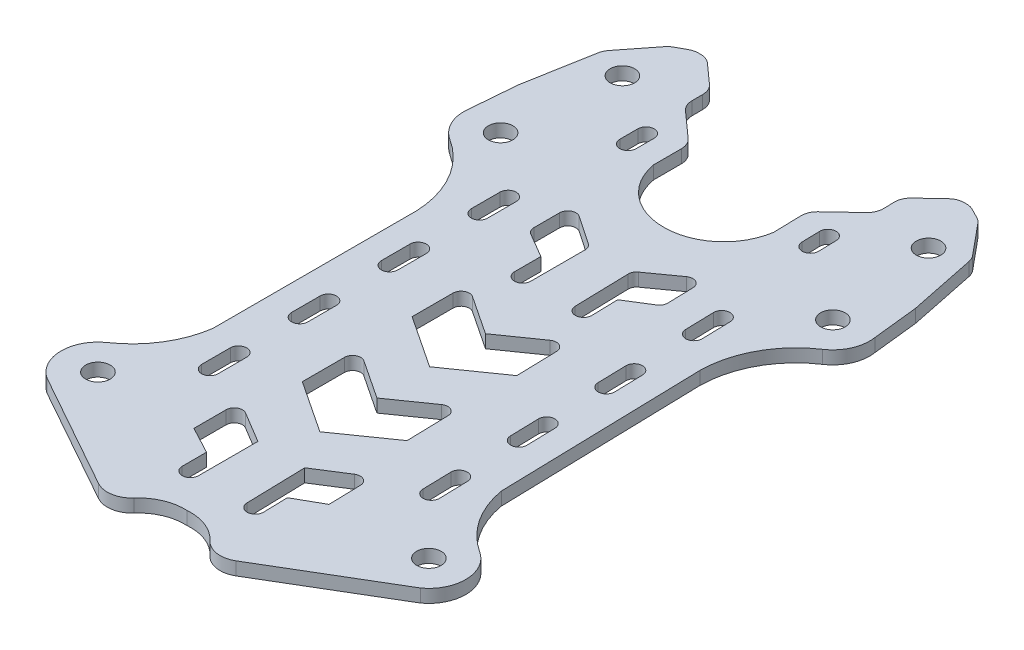
from build123d import *

# Parameters (mm, degrees)
SKETCH1_R           = 1.5
BOSS_EXTRUDE2_DEPTH = 1.6


with BuildPart() as part:
    # Sketch1 → Boss-Extrude2 (new body)
    with BuildSketch(Plane(origin=(0, 0, 0), x_dir=(1, 0, 0), z_dir=(0, 1, 0))):
        with BuildLine():
            Line((453.589712256, 423.881802968), (467.945856876, 415.84408128))
            ThreePointArc((467.945856876, 415.84408128), (469.915446977, 415.504375154), (471.661326417, 416.477303928))
            ThreePointArc((471.661326417, 416.477303928), (473.724813191, 417.95928402), (476.227640643, 418.395285632))
            ThreePointArc((476.227640643, 418.395285632), (478.740771184, 418.023240551), (480.841373273, 416.594355138))
            ThreePointArc((480.841373273, 416.594355138), (482.611491962, 415.666257489), (484.571780229, 416.056071966))
            Line((484.571780229, 416.056071966), (498.718319207, 424.457220296))
            ThreePointArc((498.718319207, 424.457220296), (500.60414794, 428.220847289), (498.55289687, 431.896933143))
            ThreePointArc((498.55289687, 431.896933143), (495.165676859, 435.255036212), (493.406451682, 439.68845954))
            Line((493.406451682, 439.68845954), (492.770294469, 464.630549387))
            ThreePointArc((492.770294469, 464.630549387), (494.201033295, 470.159578476), (498.048211328, 474.380525932))
            ThreePointArc((498.048211328, 474.380525932), (499.674169908, 476.324215001), (499.992044343, 478.838300192))
            Line((499.992044343, 478.838300192), (499.38363983, 484.405897714))
            Line((499.38363983, 484.405897714), (497.693878983, 492.626839073))
            ThreePointArc((497.693878983, 492.626839073), (497.538189212, 493.088987767), (497.275280625, 493.499718573))
            Line((497.275280625, 493.499718573), (494.171978496, 497.247496024))
            ThreePointArc((494.171978496, 497.247496024), (493.886616044, 497.52911277), (493.550818117, 497.748154942))
            Line((493.550818117, 497.748154942), (492.36034492, 498.364291217))
            ThreePointArc((492.36034492, 498.364291217), (491.889311804, 498.537203924), (491.390064396, 498.587433654))
            Line((491.390064396, 498.587433654), (491.099023272, 498.580010543))
            ThreePointArc((491.099023272, 498.580010543), (490.388435585, 498.429983084), (489.77827067, 498.036102551))
            Line((489.77827067, 498.036102551), (487.452310196, 495.843896216))
            ThreePointArc((487.452310196, 495.843896216), (486.977868904, 495.157603094), (486.824707159, 494.33746026))
            Line((486.824707159, 494.33746026), (486.857438427, 493.054151331))
            ThreePointArc((486.857438427, 493.054151331), (486.704276682, 492.234008496), (486.22983539, 491.547715375))
            Line((486.22983539, 491.547715375), (483.18736048, 488.680197699))
            ThreePointArc((483.18736048, 488.680197699), (482.712919188, 487.993904577), (482.559757443, 487.173761743))
            Line((482.559757443, 487.173761743), (482.646361727, 483.778230276))
            ThreePointArc((482.646361727, 483.778230276), (480.207052977, 479.354277202), (475.472858534, 477.591044107))
            ThreePointArc((475.472858534, 477.591044107), (470.695245902, 479.232995847), (468.143932306, 483.593315435))
            Line((468.143932306, 483.593315435), (468.143932306, 486.98995116))
            ThreePointArc((468.143932306, 486.98995116), (467.969909108, 487.805922186), (467.47812359, 488.479895325))
            Line((467.47812359, 488.479895325), (464.363524478, 491.268906543))
            ThreePointArc((464.363524478, 491.268906543), (463.87173896, 491.942879682), (463.697715763, 492.758850708))
            Line((463.697715763, 492.758850708), (463.697715763, 494.042576981))
            ThreePointArc((463.697715763, 494.042576981), (463.523692566, 494.858548007), (463.031907047, 495.532521147))
            Line((463.031907047, 495.532521147), (460.650807896, 497.664709593))
            ThreePointArc((460.650807896, 497.664709593), (460.030798545, 498.042904653), (459.316616611, 498.174765428))
            Line((459.316616611, 498.174765428), (459.025480838, 498.174765428))
            ThreePointArc((459.025480838, 498.174765428), (458.527676448, 498.111822678), (458.061205236, 497.926956217))
            Line((458.061205236, 497.926956217), (456.886828739, 497.280666663))
            ThreePointArc((456.886828739, 497.280666663), (456.556724917, 497.053133837), (456.278635641, 496.764332737))
            Line((456.278635641, 496.764332737), (453.271899778, 492.938648567))
            ThreePointArc((453.271899778, 492.938648567), (453.019549098, 492.52134789), (452.875693384, 492.055379807))
            Line((452.875693384, 492.055379807), (451.396091861, 483.794027141))
            Line((451.396091861, 483.794027141), (450.929842608, 478.212727126))
            ThreePointArc((450.929842608, 478.212727126), (451.311715525, 475.707564142), (452.986703892, 473.805964165))
            ThreePointArc((452.986703892, 473.805964165), (456.940253019, 469.684480748), (458.511500789, 464.193728824))
            Line((458.511500789, 464.193728824), (458.511500789, 439.243527583))
            ThreePointArc((458.511500789, 439.243527583), (456.86588688, 434.766690476), (453.565389879, 431.323314926))
            ThreePointArc((453.565389879, 431.323314926), (451.608535123, 427.596123273), (453.589712256, 423.881802968))
        make_face()
        with Locations(Location((456.108511087, 427.61083132, 0), (0, 0, 270))):
            Circle(SKETCH1_R, mode=Mode.SUBTRACT)
        with BuildLine():
            Line((469.460195139, 432.320358064), (473.246975462, 430.049235602))
            Line((473.246975462, 430.049235602), (473.246975462, 422.799270755))
            Line((473.246975462, 422.799270755), (473.246975462, 422.774922206))
            ThreePointArc((473.246975462, 422.774922206), (472.240962321, 421.787115008), (471.247049571, 422.78709648))
            Line((471.247049571, 422.78709648), (471.247049571, 425.761347508))
            Line((471.247049571, 425.761347508), (467.945856876, 427.521589717))
            Line((467.945856876, 427.521589717), (467.945856876, 431.462770662))
            ThreePointArc((467.945856876, 431.462770662), (468.453078154, 432.332925321), (469.460195139, 432.320358064))
        make_face(mode=Mode.SUBTRACT)
        with BuildLine():
            ThreePointArc((461.635951748, 438.279668788), (462.635951748, 439.279668788), (463.635951748, 438.279668788))
            Line((463.635951748, 438.279668788), (463.635951748, 434.779668788))
            ThreePointArc((463.635951748, 434.779668788), (462.635951748, 433.779668788), (461.635951748, 434.779668788))
            Line((461.635951748, 434.779668788), (461.635951748, 438.279668788))
        make_face(mode=Mode.SUBTRACT)
        with BuildLine():
            ThreePointArc((461.635951748, 449.279668788), (462.635951748, 450.279668788), (463.635951748, 449.279668788))
            Line((463.635951748, 449.279668788), (463.635951748, 445.779668788))
            ThreePointArc((463.635951748, 445.779668788), (462.635951748, 444.779668788), (461.635951748, 445.779668788))
            Line((461.635951748, 445.779668788), (461.635951748, 449.279668788))
        make_face(mode=Mode.SUBTRACT)
        with BuildLine():
            Line((479.09504805, 422.873837256), (478.910195135, 430.121445115))
            Line((478.910195135, 430.121445115), (482.637837379, 432.488381058))
            ThreePointArc((482.637837379, 432.488381058), (483.644306517, 432.52662277), (484.173549297, 431.669683661))
            Line((484.173549297, 431.669683661), (484.274037893, 427.729784007))
            Line((484.274037893, 427.729784007), (481.018799458, 425.885943293))
            Line((481.018799458, 425.885943293), (481.094634167, 422.912659204))
            ThreePointArc((481.094634167, 422.912659204), (480.126541147, 421.887660959), (479.095668867, 422.849496622))
            Line((479.095668867, 422.849496622), (479.09504805, 422.873837256))
        make_face(mode=Mode.SUBTRACT)
        with Locations(Location((496.105259921, 428.120814319, 0), (0, 0, 270))):
            Circle(SKETCH1_R, mode=Mode.SUBTRACT)
        with BuildLine():
            Line((471.187972381, 445.082310129), (475.927466202, 441.937250248))
            Line((475.927466202, 441.937250248), (480.585229362, 445.202130901))
            ThreePointArc((480.585229362, 445.202130901), (481.609394575, 445.276205059), (482.158891125, 444.408763473))
            Line((482.158891125, 444.408763473), (482.290119782, 439.26362501))
            Line((482.290119782, 439.26362501), (476.017617673, 434.866885615))
            Line((476.017617673, 434.866885615), (469.635050772, 439.102265143))
            Line((469.635050772, 439.102265143), (469.635050772, 444.249076852))
            ThreePointArc((469.635050772, 444.249076852), (470.162251454, 445.130246986), (471.187972381, 445.082310129))
        make_face(mode=Mode.SUBTRACT)
        with BuildLine():
            Line((471.015671468, 458.540811838), (475.755868023, 455.395285632))
            Line((475.755868023, 455.395285632), (480.4143218, 458.660650375))
            ThreePointArc((480.4143218, 458.660650375), (481.438487013, 458.734724533), (481.987983563, 457.867282948))
            Line((481.987983563, 457.867282948), (482.115510052, 452.867296983))
            Line((482.115510052, 452.867296983), (475.844152311, 448.471359738))
            Line((475.844152311, 448.471359738), (469.462749858, 452.705966555))
            Line((469.462749858, 452.705966555), (469.462749858, 457.707578561))
            ThreePointArc((469.462749858, 457.707578561), (469.98995054, 458.588748694), (471.015671468, 458.540811838))
        make_face(mode=Mode.SUBTRACT)
        with BuildLine():
            Line((488.397482052, 435.095393437), (488.308242281, 438.594255575))
            ThreePointArc((488.308242281, 438.594255575), (489.282420101, 439.619427549), (490.307592075, 438.64524973))
            Line((490.307592075, 438.64524973), (490.396831846, 435.146387592))
            ThreePointArc((490.396831846, 435.146387592), (489.422654027, 434.121215618), (488.397482052, 435.095393437))
        make_face(mode=Mode.SUBTRACT)
        with BuildLine():
            Line((488.117014201, 446.0918173), (488.02777443, 449.590679439))
            ThreePointArc((488.02777443, 449.590679439), (489.001952249, 450.615851413), (490.027124223, 449.641673593))
            Line((490.027124223, 449.641673593), (490.116363994, 446.142811455))
            ThreePointArc((490.116363994, 446.142811455), (489.142186175, 445.117639481), (488.117014201, 446.0918173))
        make_face(mode=Mode.SUBTRACT)
        with BuildLine():
            ThreePointArc((461.635951748, 460.279668788), (462.635951748, 461.279668788), (463.635951748, 460.279668788))
            Line((463.635951748, 460.279668788), (463.635951748, 456.779668788))
            ThreePointArc((463.635951748, 456.779668788), (462.635951748, 455.779668788), (461.635951748, 456.779668788))
            Line((461.635951748, 456.779668788), (461.635951748, 460.279668788))
        make_face(mode=Mode.SUBTRACT)
        with Locations(Location((455.389407771, 477.61083132, 0), (0, 0, 270))):
            Circle(SKETCH1_R, mode=Mode.SUBTRACT)
        with BuildLine():
            ThreePointArc((461.635951748, 471.279668788), (462.635951748, 472.279668788), (463.635951748, 471.279668788))
            Line((463.635951748, 471.279668788), (463.635951748, 467.779668788))
            ThreePointArc((463.635951748, 467.779668788), (462.635951748, 466.779668788), (461.635951748, 467.779668788))
            Line((461.635951748, 467.779668788), (461.635951748, 471.279668788))
        make_face(mode=Mode.SUBTRACT)
        with BuildLine():
            Line((472.965894623, 470.380866665), (472.965894623, 463.732394135))
            ThreePointArc((472.965894623, 463.732394135), (471.965894623, 462.732394135), (470.965894623, 463.732394135))
            Line((470.965894623, 463.732394135), (470.965894623, 466.963746591))
            Line((470.965894623, 466.963746591), (467.970293389, 468.729657655))
            ThreePointArc((467.970293389, 468.729657655), (467.609840744, 469.095045392), (467.47812359, 469.591114842))
            Line((467.47812359, 469.591114842), (467.47812359, 472.748724337))
            ThreePointArc((467.47812359, 472.748724337), (468.0099832, 473.63237844), (469.03981274, 473.576072691))
            Line((469.03981274, 473.576072691), (472.527583773, 471.208215019))
            ThreePointArc((472.527583773, 471.208215019), (472.849548727, 470.849007055), (472.965894623, 470.380866665))
        make_face(mode=Mode.SUBTRACT)
        with Locations(Location((456.798969195, 491.11083132, 0), (0, 0, 270))):
            Circle(SKETCH1_R, mode=Mode.SUBTRACT)
        with BuildLine():
            ThreePointArc((463.363524478, 486.431340003), (464.363524478, 487.431340003), (465.363524478, 486.431340003))
            Line((465.363524478, 486.431340003), (465.363524478, 484.231340003))
            ThreePointArc((465.363524478, 484.231340003), (464.363524478, 483.231340003), (463.363524478, 484.231340003))
            Line((463.363524478, 484.231340003), (463.363524478, 486.431340003))
        make_face(mode=Mode.SUBTRACT)
        with BuildLine():
            Line((483.198924026, 468.923832005), (480.249322243, 467.082115968))
            Line((480.249322243, 467.082115968), (480.331712286, 463.851814036))
            ThreePointArc((480.331712286, 463.851814036), (479.357534467, 462.826642062), (478.332362493, 463.800819881))
            Line((478.332362493, 463.800819881), (478.162845874, 470.447130971))
            ThreePointArc((478.162845874, 470.447130971), (478.267217734, 470.918085647), (478.579919263, 471.285385996))
            Line((478.579919263, 471.285385996), (482.006182959, 473.741401838))
            ThreePointArc((482.006182959, 473.741401838), (483.034242067, 473.823946926), (483.588459364, 472.954140967))
            Line((483.588459364, 472.954140967), (483.668969178, 469.797558022))
            ThreePointArc((483.668969178, 469.797558022), (483.549943167, 469.298291443), (483.198924026, 468.923832005))
        make_face(mode=Mode.SUBTRACT)
        with BuildLine():
            Line((487.836546349, 457.088241164), (487.747306578, 460.587103302))
            ThreePointArc((487.747306578, 460.587103302), (488.721484398, 461.612275276), (489.746656372, 460.638097457))
            Line((489.746656372, 460.638097457), (489.835896143, 457.139235318))
            ThreePointArc((489.835896143, 457.139235318), (488.861718323, 456.114063344), (487.836546349, 457.088241164))
        make_face(mode=Mode.SUBTRACT)
        with BuildLine():
            Line((487.556078498, 468.084665027), (487.466838727, 471.583527165))
            ThreePointArc((487.466838727, 471.583527165), (488.441016546, 472.60869914), (489.46618852, 471.63452132))
            Line((489.46618852, 471.63452132), (489.555428291, 468.135659182))
            ThreePointArc((489.555428291, 468.135659182), (488.581250472, 467.110487208), (487.556078498, 468.084665027))
        make_face(mode=Mode.SUBTRACT)
        with BuildLine():
            Line((485.409597873, 484.486939693), (485.353504302, 486.686224466))
            ThreePointArc((485.353504302, 486.686224466), (486.327682122, 487.71139644), (487.352854096, 486.737218621))
            Line((487.352854096, 486.737218621), (487.408947666, 484.537933848))
            ThreePointArc((487.408947666, 484.537933848), (486.434769847, 483.512761874), (485.409597873, 484.486939693))
        make_face(mode=Mode.SUBTRACT)
        with Locations(Location((495.549275584, 478.122894186, 0), (0, 0, 270))):
            Circle(SKETCH1_R, mode=Mode.SUBTRACT)
        with Locations(Location((493.795961867, 491.582565594, 0), (0, 0, 270))):
            Circle(SKETCH1_R, mode=Mode.SUBTRACT)
    extrude(amount=BOSS_EXTRUDE2_DEPTH)


solid = part.part
